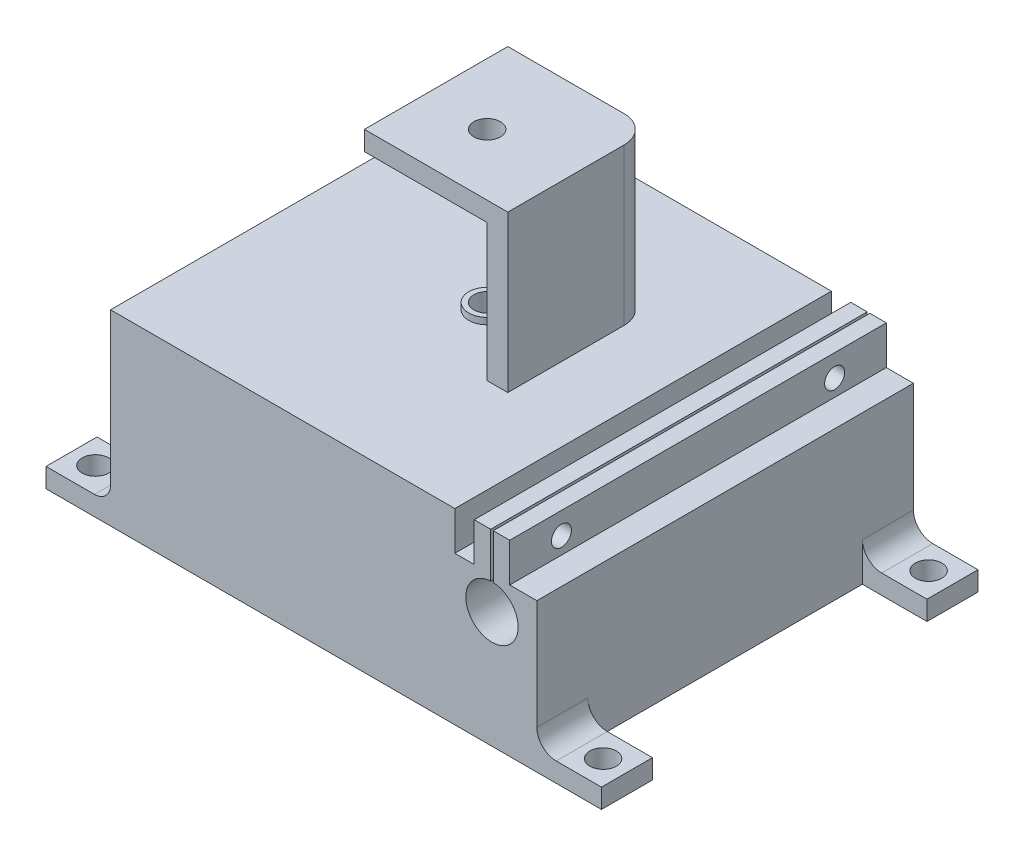
from build123d import *

# Parameters (mm, degrees)
SKETCH1_W           = 66
SKETCH1_H           = 58.3
SKETCH1_R           = 2.05
BOSS_EXTRUDE1_DEPTH = 29
CUT_EXTRUDE1_START  = -29
CUT_EXTRUDE1_DEPTH  = 20
SKETCH6_W           = 10
SKETCH6_H           = 7.9
SKETCH6_R           = 2.05
BOSS_EXTRUDE2_DEPTH = 3
BOSS_EXTRUDE4_DEPTH = 7.9
BOSS_EXTRUDE5_START = -50.4
BOSS_EXTRUDE5_DEPTH = 7.9
CUT_EXTRUDE4_START  = -58.3
SKETCH8_R           = 4.05
CUT_EXTRUDE4_DEPTH  = 58.3
CUT_EXTRUDE5_REACH  = 80.031
SKETCH10_W          = 3
SKETCH10_H          = 6
SKETCH10_W_2        = 4.2
SKETCH10_W_3        = 0.4
SKETCH10_H_2        = 7.617508416
CUT_EXTRUDE6_REACH  = 84.74
SKETCH11_R          = 1.55
CUT_EXTRUDE7_DEPTH  = 2.5
BOSS_EXTRUDE6_DEPTH = 21.2
SKETCH14_R          = 2.05
BOSS_EXTRUDE7_DEPTH = 3
BOSS_EXTRUDE8_START = -4
SKETCH15_R          = 2.85
SKETCH15_R_2        = 2.05
BOSS_EXTRUDE8_DEPTH = 1
BOSS_EXTRUDE9_START = -24.2
SKETCH15_2_R        = 2.85
SKETCH15_2_R_2      = 2.05
BOSS_EXTRUDE9_DEPTH = 1


with BuildPart() as part:
    # Sketch1 → Boss-Extrude1 (new body)
    with BuildSketch(Plane(origin=(0, 0, 0), x_dir=(1, 0, 0), z_dir=(0, 1, 0))):
        Rectangle(SKETCH1_W, SKETCH1_H)
        with Locations(Location((-3.85, 0, 0), (0, 0, 90))):
            Circle(SKETCH1_R, mode=Mode.SUBTRACT)
    extrude(amount=BOSS_EXTRUDE1_DEPTH)

    # Sketch3 → Cut-Extrude1 (cut)
    with BuildSketch(Plane(origin=(0, 29, 0), x_dir=(1, 0, 0), z_dir=(0, 1, 0)).offset(CUT_EXTRUDE1_START)):
        Polygon((-33, 21.25), (-33, -21.25), (17.4, -21.25), (17.4, 21.25), (-25.1, 21.25), align=None)
    extrude(amount=CUT_EXTRUDE1_DEPTH, mode=Mode.SUBTRACT)

    # Sketch6 → Boss-Extrude2 (add)
    # profile 1 of 4: a face of its own
    with BuildSketch(Plane.XZ):
        with Locations((-38, 25.2)):
            Rectangle(SKETCH6_W, SKETCH6_H)
        with Locations(Location((-39.3, 25.2, 0), (0, 0, 270))):
            Circle(SKETCH6_R, mode=Mode.SUBTRACT)
    # profile 2 of 4: a face of its own
    with BuildSketch(Plane.XZ):
        with Locations((-38, -25.2)):
            Rectangle(SKETCH6_W, SKETCH6_H)
        with Locations(Location((-39.3, -25.2, 0), (0, 0, 270))):
            Circle(SKETCH6_R, mode=Mode.SUBTRACT)
    # profile 3 of 4: a face of its own
    with BuildSketch(Plane.XZ):
        with Locations((38, 25.2)):
            Rectangle(SKETCH6_W, SKETCH6_H)
        with Locations(Location((39.3, 25.2, 0), (0, 0, 270))):
            Circle(SKETCH6_R, mode=Mode.SUBTRACT)
    # profile 4 of 4: a face of its own
    with BuildSketch(Plane.XZ):
        with Locations((38, -25.2)):
            Rectangle(SKETCH6_W, SKETCH6_H)
        with Locations(Location((39.3, -25.2, 0), (0, 0, 270))):
            Circle(SKETCH6_R, mode=Mode.SUBTRACT)
    extrude(amount=-BOSS_EXTRUDE2_DEPTH)

    # Sketch7 → Boss-Extrude4 (add)
    with BuildSketch(Plane(origin=(0, 0, -29.15), x_dir=(-1, 0, 0), z_dir=(0, 0, -1))):
        with BuildLine():
            ThreePointArc((35.5, 3), (33.732233047, 3.732233047), (33, 5.5))
            Line((33, 5.5), (33, 3))
            Line((33, 3), (35.5, 3))
        make_face()
        with BuildLine():
            ThreePointArc((-33, 6), (-33.878679656, 3.878679656), (-36, 3))
            Line((-36, 3), (-33, 3))
            Line((-33, 3), (-33, 6))
        make_face()
    extrude(amount=-BOSS_EXTRUDE4_DEPTH)

    # Sketch7<5> → Boss-Extrude5 (add)
    with BuildSketch(Plane(origin=(0, 0, -29.15), x_dir=(-1, 0, 0), z_dir=(0, 0, -1)).offset(BOSS_EXTRUDE5_START)):
        with BuildLine():
            ThreePointArc((35.5, 3), (33.732233047, 3.732233047), (33, 5.5))
            Line((33, 5.5), (33, 3))
            Line((33, 3), (35.5, 3))
        make_face()
        with BuildLine():
            ThreePointArc((-33, 6), (-33.878679656, 3.878679656), (-36, 3))
            Line((-36, 3), (-33, 3))
            Line((-33, 3), (-33, 6))
        make_face()
    extrude(amount=-BOSS_EXTRUDE5_DEPTH)

    # Sketch8 → Cut-Extrude4 (cut)
    with BuildSketch(Plane.XY.offset(29.15).offset(CUT_EXTRUDE4_START)):
        with Locations(Location((26.05, 18, 0), (0, 0, 180))):
            Circle(SKETCH8_R)
    extrude(amount=CUT_EXTRUDE4_DEPTH, mode=Mode.SUBTRACT)

    # Sketch10 → Cut-Extrude5 (cut, up to next)
    with BuildSketch(Plane(origin=(0, 0, -29.15), x_dir=(-1, 0, 0), z_dir=(0, 0, -1)), mode=Mode.PRIVATE) as cut_extrude5_sk1:
        with Locations((-21.8, 26)):
            Rectangle(SKETCH10_W, SKETCH10_H)
    cut_extrude5_tool1 = extrude(cut_extrude5_sk1.sketch, amount=-CUT_EXTRUDE5_REACH, mode=Mode.PRIVATE) & part.part
    # Sketch10 → Cut-Extrude5 (cut, up to next)
    with BuildSketch(Plane(origin=(0, 0, -29.15), x_dir=(-1, 0, 0), z_dir=(0, 0, -1)), mode=Mode.PRIVATE) as cut_extrude5_sk2:
        with Locations((-30.9, 26)):
            Rectangle(SKETCH10_W_2, SKETCH10_H)
    cut_extrude5_tool2 = extrude(cut_extrude5_sk2.sketch, amount=-CUT_EXTRUDE5_REACH, mode=Mode.PRIVATE) & part.part
    # Sketch10 → Cut-Extrude5 (cut, up to next)
    with BuildSketch(Plane(origin=(0, 0, -29.15), x_dir=(-1, 0, 0), z_dir=(0, 0, -1)), mode=Mode.PRIVATE) as cut_extrude5_sk3:
        with Locations((-26.05, 25.191245792)):
            Rectangle(SKETCH10_W_3, SKETCH10_H_2)
    cut_extrude5_tool3 = extrude(cut_extrude5_sk3.sketch, amount=-CUT_EXTRUDE5_REACH, mode=Mode.PRIVATE) & part.part
    add(cut_extrude5_tool1.solids().sort_by_distance((21.8, 26, -29.15))[0], mode=Mode.SUBTRACT)
    add(cut_extrude5_tool2.solids().sort_by_distance((30.9, 26, -29.15))[0], mode=Mode.SUBTRACT)
    add(cut_extrude5_tool3.solids().sort_by_distance((26.05, 25.191246, -29.15))[0], mode=Mode.SUBTRACT)

    # Cut-Extrude6: up to this face of the body (flat: up to its plane)
    cut_extrude6_end = Plane(part.part.faces().sort_by_distance((23.3, 26, 0))[0])
    # Sketch11 → Cut-Extrude6 (cut, up to the picked face)
    with BuildSketch(Plane(origin=(28.8, 0, 0), x_dir=(0, 0, -1), z_dir=(1, 0, 0)), mode=Mode.PRIVATE) as cut_extrude6_sk1:
        with Locations((-21.15, 25.6)):
            Circle(SKETCH11_R)
    cut_extrude6_tool1 = split(extrude(cut_extrude6_sk1.sketch, amount=-CUT_EXTRUDE6_REACH, mode=Mode.PRIVATE), bisect_by=cut_extrude6_end, keep=Keep.BOTH, mode=Mode.PRIVATE)
    # Sketch11 → Cut-Extrude6 (cut, up to the picked face)
    with BuildSketch(Plane(origin=(28.8, 0, 0), x_dir=(0, 0, -1), z_dir=(1, 0, 0)), mode=Mode.PRIVATE) as cut_extrude6_sk2:
        with Locations((21.15, 25.6)):
            Circle(SKETCH11_R)
    cut_extrude6_tool2 = split(extrude(cut_extrude6_sk2.sketch, amount=-CUT_EXTRUDE6_REACH, mode=Mode.PRIVATE), bisect_by=cut_extrude6_end, keep=Keep.BOTH, mode=Mode.PRIVATE)
    add(cut_extrude6_tool1.solids().sort_by(Axis((28.8, 25.6, 21.15), (-1, 0, 0)))[0], mode=Mode.SUBTRACT)
    add(cut_extrude6_tool2.solids().sort_by(Axis((28.8, 25.6, -21.15), (-1, 0, 0)))[0], mode=Mode.SUBTRACT)

    # Sketch12 → Cut-Extrude7 (cut)
    with BuildSketch(Plane.XZ.offset(-20)):
        Polygon((-7.95, 0), (-5.9, -3.550704156), (-1.8, -3.550704156), (0.25, 0), (-1.8, 3.550704156), (-5.9, 3.550704156), align=None)
    extrude(amount=-CUT_EXTRUDE7_DEPTH, mode=Mode.SUBTRACT)

    # Sketch13 → Boss-Extrude6 (add)
    with BuildSketch(Plane(origin=(0, 29, 0), x_dir=(1, 0, 0), z_dir=(0, 1, 0))):
        with BuildLine():
            Line((-13.35, 9.5), (-13.35, 12.7))
            Line((-13.35, 12.7), (4.65, 12.7))
            ThreePointArc((4.65, 12.7), (7.619848481, 11.469848481), (8.85, 8.5))
            Line((8.85, 8.5), (8.85, -9.5))
            Line((8.85, -9.5), (5.65, -9.5))
            Line((5.65, -9.5), (5.65, 6.3))
            ThreePointArc((5.65, 6.3), (4.7127417, 8.5627417), (2.45, 9.5))
            Line((2.45, 9.5), (-13.35, 9.5))
        make_face()
    extrude(amount=BOSS_EXTRUDE6_DEPTH)

    # Sketch14 → Boss-Extrude7 (add)
    with BuildSketch(Plane(origin=(0, 50.2, 0), x_dir=(1, 0, 0), z_dir=(0, 1, 0))):
        with BuildLine():
            Line((-13.35, 12.7), (4.65, 12.7))
            ThreePointArc((4.65, 12.7), (7.619848481, 11.469848481), (8.85, 8.5))
            Line((8.85, 8.5), (8.85, -9.5))
            Line((8.85, -9.5), (-13.35, -9.5))
            Line((-13.35, -9.5), (-13.35, 12.7))
        make_face()
        with Locations(Location((-3.85, 0, 0), (0, 0, 90))):
            Circle(SKETCH14_R, mode=Mode.SUBTRACT)
    extrude(amount=BOSS_EXTRUDE7_DEPTH)

    # Sketch15 → Boss-Extrude8 (add)
    with BuildSketch(Plane(origin=(0, 53.2, 0), x_dir=(1, 0, 0), z_dir=(0, 1, 0)).offset(BOSS_EXTRUDE8_START)):
        with Locations(Location((-3.85, 0, 0), (0, 0, 270))):
            Circle(SKETCH15_R)
        with Locations(Location((-3.85, 0, 0), (0, 0, 90))):
            Circle(SKETCH15_R_2, mode=Mode.SUBTRACT)
    extrude(amount=BOSS_EXTRUDE8_DEPTH)

    # Sketch15<2> → Boss-Extrude9 (add)
    with BuildSketch(Plane(origin=(0, 53.2, 0), x_dir=(1, 0, 0), z_dir=(0, 1, 0)).offset(BOSS_EXTRUDE9_START)):
        with Locations(Location((-3.85, 0, 0), (0, 0, 270))):
            Circle(SKETCH15_2_R)
        with Locations(Location((-3.85, 0, 0), (0, 0, 90))):
            Circle(SKETCH15_2_R_2, mode=Mode.SUBTRACT)
    extrude(amount=BOSS_EXTRUDE9_DEPTH)


solid = part.part
